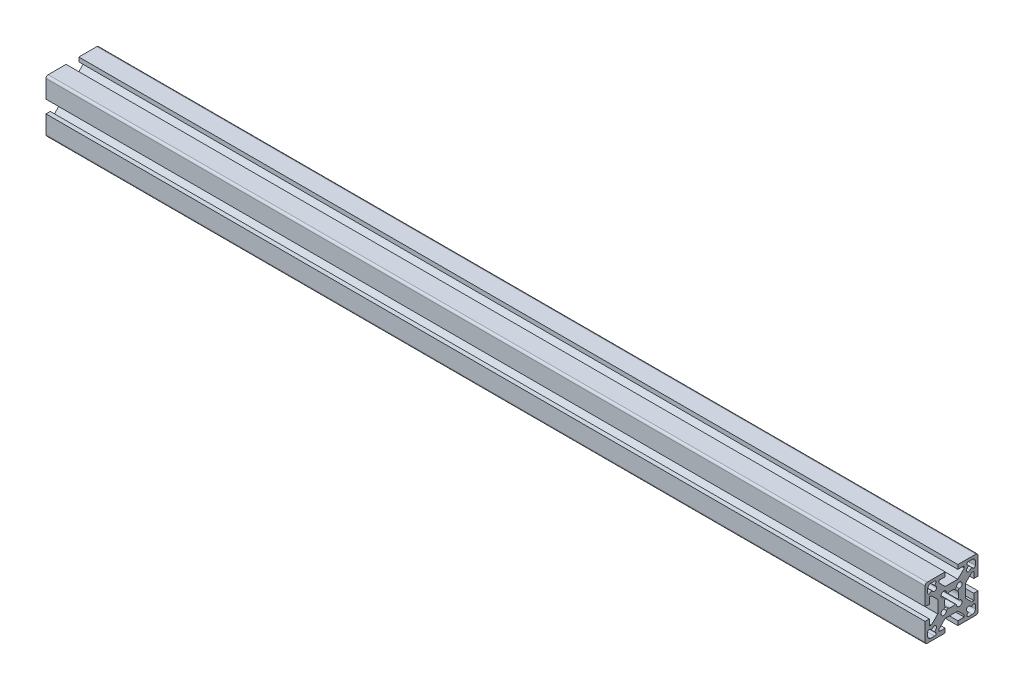
from build123d import *

# Parameters (mm, degrees)
BOSS_EXTRUDE1_DEPTH = 415


with BuildPart() as part:
    # Sketch1 → Boss-Extrude1 (new body)
    with BuildSketch(Plane(origin=(0, 0, 0), x_dir=(0, 0, -1), z_dir=(1, 0, 0))):
        with BuildLine():
            Line((-12.5, 11.5), (-12.5, 3))
            Line((-12.5, 3), (-10.5, 3))
            Line((-10.5, 3), (-10.5, 6))
            Line((-10.5, 6), (-9.535533906, 6))
            Line((-9.535533906, 6), (-6.5, 2.964466094))
            Line((-6.5, 2.964466094), (-6.5, -2.964466094))
            Line((-6.5, -2.964466094), (-9.535533906, -6))
            Line((-9.535533906, -6), (-10.5, -6))
            Line((-10.5, -6), (-10.5, -3))
            Line((-10.5, -3), (-12.5, -3))
            Line((-12.5, -3), (-12.5, -11.5))
            ThreePointArc((-12.5, -11.5), (-12.207106781, -12.207106781), (-11.5, -12.5))
            Line((-11.5, -12.5), (-3, -12.5))
            Line((-3, -12.5), (-3, -10.5))
            Line((-3, -10.5), (-6, -10.5))
            Line((-6, -10.5), (-6, -9.535533906))
            Line((-6, -9.535533906), (-2.964466094, -6.5))
            Line((-2.964466094, -6.5), (2.964466094, -6.5))
            Line((2.964466094, -6.5), (6, -9.535533906))
            Line((6, -9.535533906), (6, -10.5))
            Line((6, -10.5), (3, -10.5))
            Line((3, -10.5), (3, -12.5))
            Line((3, -12.5), (11.5, -12.5))
            ThreePointArc((11.5, -12.5), (12.207106781, -12.207106781), (12.5, -11.5))
            Line((12.5, -11.5), (12.5, -3))
            Line((12.5, -3), (10.5, -3))
            Line((10.5, -3), (10.5, -6))
            Line((10.5, -6), (9.535533906, -6))
            Line((9.535533906, -6), (6.5, -2.964466094))
            Line((6.5, -2.964466094), (6.5, 2.964466094))
            Line((6.5, 2.964466094), (9.535533906, 6))
            Line((9.535533906, 6), (10.5, 6))
            Line((10.5, 6), (10.5, 3))
            Line((10.5, 3), (12.5, 3))
            Line((12.5, 3), (12.5, 11.5))
            ThreePointArc((12.5, 11.5), (12.207106781, 12.207106781), (11.5, 12.5))
            Line((11.5, 12.5), (3, 12.5))
            Line((3, 12.5), (3, 10.5))
            Line((3, 10.5), (6, 10.5))
            Line((6, 10.5), (6, 9.535533906))
            Line((6, 9.535533906), (2.964466094, 6.5))
            Line((2.964466094, 6.5), (-2.964466094, 6.5))
            Line((-2.964466094, 6.5), (-6, 9.535533906))
            Line((-6, 9.535533906), (-6, 10.5))
            Line((-6, 10.5), (-3, 10.5))
            Line((-3, 10.5), (-3, 12.5))
            Line((-3, 12.5), (-11.5, 12.5))
            ThreePointArc((-11.5, 12.5), (-12.207106781, 12.207106781), (-12.5, 11.5))
        make_face()
        with BuildLine():
            Line((-3.087755464, -1.885673936), (-3.585519377, -2.383437849))
            ThreePointArc((-3.585519377, -2.383437849), (-4.599238816, -4.599238816), (-2.383437849, -3.585519377))
            Line((-2.383437849, -3.585519377), (-1.885673936, -3.087755464))
            ThreePointArc((-1.885673936, -3.087755464), (-1.720751743, -3.0036254), (-1.537849315, -3.032329053))
            ThreePointArc((-1.537849315, -3.032329053), (0, -3.4), (1.537849315, -3.032329053))
            ThreePointArc((1.537849315, -3.032329053), (1.720751743, -3.0036254), (1.885673936, -3.087755464))
            Line((1.885673936, -3.087755464), (2.383437849, -3.585519377))
            ThreePointArc((2.383437849, -3.585519377), (4.599238816, -4.599238816), (3.585519377, -2.383437849))
            Line((3.585519377, -2.383437849), (3.087755464, -1.885673936))
            ThreePointArc((3.087755464, -1.885673936), (3.0036254, -1.720751743), (3.032329053, -1.537849315))
            ThreePointArc((3.032329053, -1.537849315), (3.4, 0), (3.032329053, 1.537849315))
            ThreePointArc((3.032329053, 1.537849315), (3.0036254, 1.720751743), (3.087755464, 1.885673936))
            Line((3.087755464, 1.885673936), (3.585519377, 2.383437849))
            ThreePointArc((3.585519377, 2.383437849), (4.599238816, 4.599238816), (2.383437849, 3.585519377))
            Line((2.383437849, 3.585519377), (1.885673936, 3.087755464))
            ThreePointArc((1.885673936, 3.087755464), (1.720751743, 3.0036254), (1.537849315, 3.032329053))
            ThreePointArc((1.537849315, 3.032329053), (0, 3.4), (-1.537849315, 3.032329053))
            ThreePointArc((-1.537849315, 3.032329053), (-1.720751743, 3.0036254), (-1.885673936, 3.087755464))
            Line((-1.885673936, 3.087755464), (-2.383437849, 3.585519377))
            ThreePointArc((-2.383437849, 3.585519377), (-4.599238816, 4.599238816), (-3.585519377, 2.383437849))
            Line((-3.585519377, 2.383437849), (-3.087755464, 1.885673936))
            ThreePointArc((-3.087755464, 1.885673936), (-3.0036254, 1.720751743), (-3.032329053, 1.537849315))
            ThreePointArc((-3.032329053, 1.537849315), (-3.4, 0), (-3.032329053, -1.537849315))
            ThreePointArc((-3.032329053, -1.537849315), (-3.0036254, -1.720751743), (-3.087755464, -1.885673936))
        make_face(mode=Mode.SUBTRACT)
        with BuildLine():
            Line((-11.25, 9.75), (-11.25, 7.976197667))
            ThreePointArc((-11.25, 7.976197667), (-10.817878403, 7.329481994), (-10.055025253, 7.48122292))
            Line((-10.055025253, 7.48122292), (-9.475230868, 8.061017306))
            Line((-9.475230868, 8.061017306), (-8.768124087, 7.353910524))
            ThreePointArc((-8.768124087, 7.353910524), (-7.353910524, 7.353910524), (-7.353910524, 8.768124087))
            Line((-7.353910524, 8.768124087), (-8.061017306, 9.475230868))
            Line((-8.061017306, 9.475230868), (-7.48122292, 10.055025253))
            ThreePointArc((-7.48122292, 10.055025253), (-7.329481994, 10.817878403), (-7.976197667, 11.25))
            Line((-7.976197667, 11.25), (-9.75, 11.25))
            ThreePointArc((-9.75, 11.25), (-10.810660172, 10.810660172), (-11.25, 9.75))
        make_face(mode=Mode.SUBTRACT)
        with BuildLine():
            Line((8.061017306, 9.475230868), (7.353910524, 8.768124087))
            ThreePointArc((7.353910524, 8.768124087), (7.353910524, 7.353910524), (8.768124087, 7.353910524))
            Line((8.768124087, 7.353910524), (9.475230868, 8.061017306))
            Line((9.475230868, 8.061017306), (10.055025253, 7.48122292))
            ThreePointArc((10.055025253, 7.48122292), (10.817878403, 7.329481994), (11.25, 7.976197667))
            Line((11.25, 7.976197667), (11.25, 9.75))
            ThreePointArc((11.25, 9.75), (10.810660172, 10.810660172), (9.75, 11.25))
            Line((9.75, 11.25), (7.976197667, 11.25))
            ThreePointArc((7.976197667, 11.25), (7.329481994, 10.817878403), (7.48122292, 10.055025253))
            Line((7.48122292, 10.055025253), (8.061017306, 9.475230868))
        make_face(mode=Mode.SUBTRACT)
        with BuildLine():
            Line((-9.475230868, -8.061017306), (-10.055025253, -7.48122292))
            ThreePointArc((-10.055025253, -7.48122292), (-10.817878403, -7.329481994), (-11.25, -7.976197667))
            Line((-11.25, -7.976197667), (-11.25, -9.75))
            ThreePointArc((-11.25, -9.75), (-10.810660172, -10.810660172), (-9.75, -11.25))
            Line((-9.75, -11.25), (-7.976197667, -11.25))
            ThreePointArc((-7.976197667, -11.25), (-7.329481994, -10.817878403), (-7.48122292, -10.055025253))
            Line((-7.48122292, -10.055025253), (-8.061017306, -9.475230868))
            Line((-8.061017306, -9.475230868), (-7.353910524, -8.768124087))
            ThreePointArc((-7.353910524, -8.768124087), (-7.353910524, -7.353910524), (-8.768124087, -7.353910524))
            Line((-8.768124087, -7.353910524), (-9.475230868, -8.061017306))
        make_face(mode=Mode.SUBTRACT)
        with BuildLine():
            Line((9.475230868, -8.061017306), (8.768124087, -7.353910524))
            ThreePointArc((8.768124087, -7.353910524), (7.353910524, -7.353910524), (7.353910524, -8.768124087))
            Line((7.353910524, -8.768124087), (8.061017306, -9.475230868))
            Line((8.061017306, -9.475230868), (7.48122292, -10.055025253))
            ThreePointArc((7.48122292, -10.055025253), (7.329481994, -10.817878403), (7.976197667, -11.25))
            Line((7.976197667, -11.25), (9.75, -11.25))
            ThreePointArc((9.75, -11.25), (10.810660172, -10.810660172), (11.25, -9.75))
            Line((11.25, -9.75), (11.25, -7.976197667))
            ThreePointArc((11.25, -7.976197667), (10.817878403, -7.329481994), (10.055025253, -7.48122292))
            Line((10.055025253, -7.48122292), (9.475230868, -8.061017306))
        make_face(mode=Mode.SUBTRACT)
    extrude(amount=BOSS_EXTRUDE1_DEPTH)


solid = part.part
